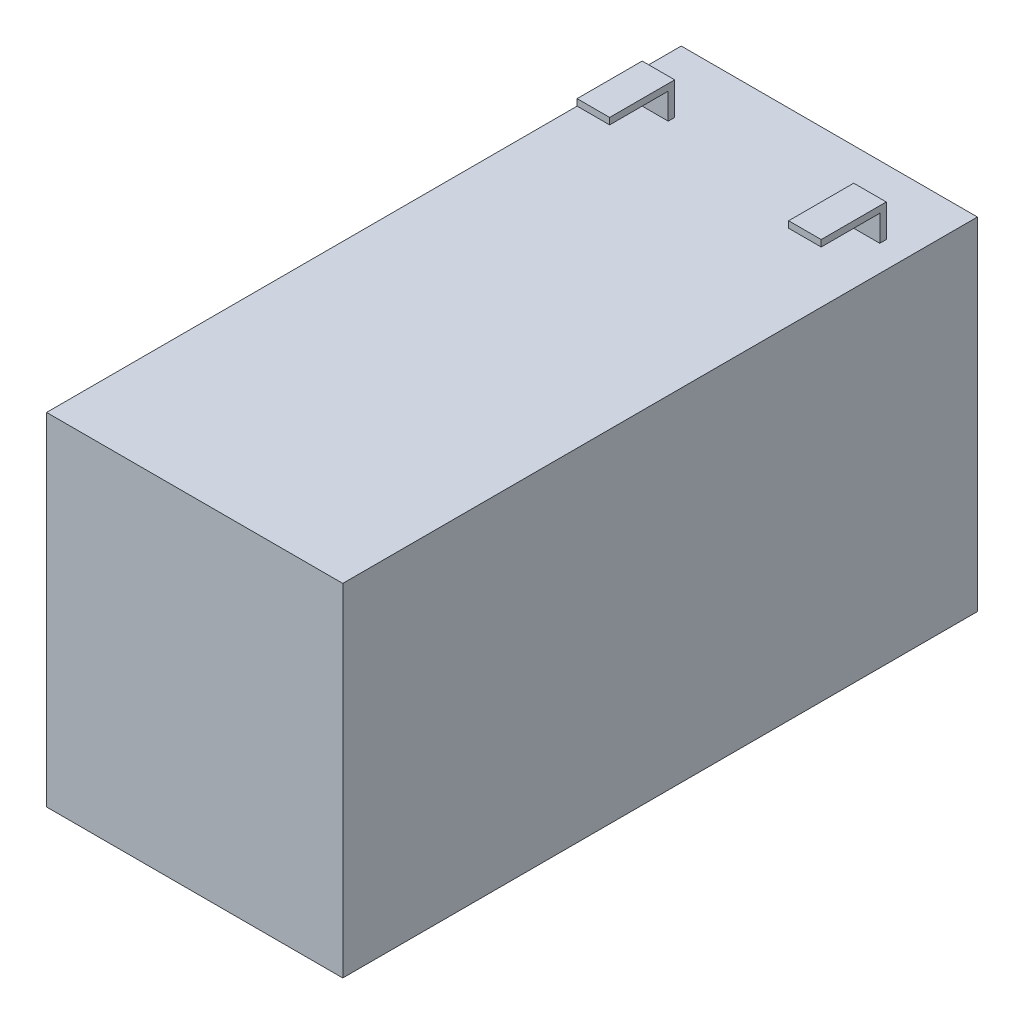
from build123d import *

# Parameters (mm, degrees)
SKETCH_1_W      = 45.5
SKETCH_1_H      = 97.5
EXTRUDE_1_DEPTH = 52.5
SKETCH_3_W      = 5
SKETCH_3_H      = 1


with BuildPart() as part:
    # 草图1 → 拉伸1 (new body)
    with BuildSketch(Plane(origin=(0, 0, 0), x_dir=(1, 0, 0), z_dir=(0, 1, 0))):
        Rectangle(SKETCH_1_W, SKETCH_1_H)
    extrude(amount=EXTRUDE_1_DEPTH)

    # 扫描1: sweep along a path in 草图4
    with BuildLine(Plane.ZY.offset(18.75)) as sweep_1_path:
        Line((-38.75, 52.5), (-38.75, 57.5))
        Line((-38.75, 57.5), (-28.75, 57.5))
    # 草图3 → 扫描1 (sweep)
    with BuildSketch(Plane(origin=(0, 52.5, 0), x_dir=(-1, 0, 0), z_dir=(0, 1, 0))):
        with Locations((16.25, -38.25)):
            Rectangle(SKETCH_3_W, SKETCH_3_H)
    sweep_1 = sweep(path=sweep_1_path.line, transition=Transition.RIGHT)

    # 镜向2: 扫描1 across plane
    add(sweep_1.mirror(Plane.ZY))


solid = part.part
